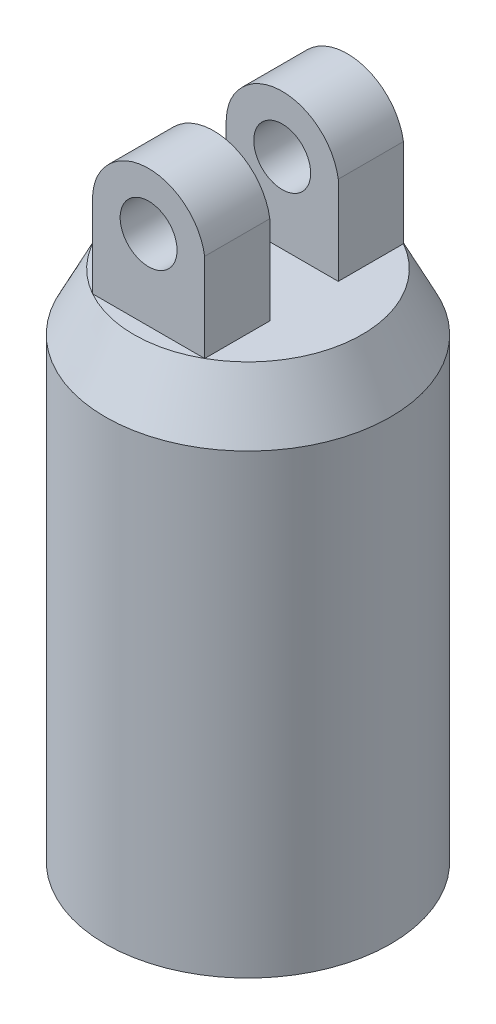
from build123d import *

# Parameters (mm, degrees)
SKETCH_1_R          = 12.5
SKETCH_1_R_2        = 5
EXTRUDE_1_DEPTH     = 40
SKETCH_9_W          = 9.82849153
SKETCH_9_H          = 17.418402746
EXTRUDE_4_DEPTH     = 15
SKETCH_12_R         = 2.492986731
CUT_EXTRUDE_2_DEPTH = 65.854299957
CUT_EXTRUDE_3_DEPTH = 65.854299957
CUT_EXTRUDE_4_DEPTH = 65.854299957
CUT_EXTRUDE_5_DEPTH = 15


with BuildPart() as part:
    # Эскиз1 → Бобышка-Вытянуть1 (new body)
    with BuildSketch(Plane(origin=(0, 0, 0), x_dir=(1, 0, 0), z_dir=(0, 1, 0))):
        Circle(SKETCH_1_R)
        Circle(SKETCH_1_R_2, mode=Mode.SUBTRACT)
    extrude(amount=EXTRUDE_1_DEPTH)

    # Эскиз4 → Повернуть2 (revolve)
    with BuildSketch(Plane(origin=(0, 0, 0), x_dir=(0, 0, -1), z_dir=(1, 0, 0))):
        Polygon((-10, 45), (0, 45), (0, 39.999913314), (-12.5, 40), align=None)
    revolve(axis=Axis((0, 39.999913314, 0), (0, 1, 0)))

    # Эскиз9 → Бобышка-Вытянуть4 (add)
    with BuildSketch(Plane(origin=(0, 45, 0), x_dir=(1, 0, 0), z_dir=(0, 1, 0))):
        Rectangle(SKETCH_9_W, SKETCH_9_H)
    extrude(amount=EXTRUDE_4_DEPTH)

    # Эскиз12 → Вырез-Вытянуть2 (cut, through all)
    with BuildSketch(Plane.XY.offset(8.709201373)):
        with Locations((0, 52)):
            Circle(SKETCH_12_R)
    extrude(amount=-CUT_EXTRUDE_2_DEPTH, mode=Mode.SUBTRACT)

    # Эскиз12<4> → Вырез-Вытянуть3 (cut, through all)
    with BuildSketch(Plane.XY.offset(8.709201373)):
        with BuildLine():
            Line((0, 57.060476342), (0, 60))
            Line((0, 60), (-4.914245765, 60))
            Line((-4.914245765, 60), (-4.914245765, 52.146230577))
            ThreePointArc((-4.914245765, 52.146230577), (-3.474896505, 55.621127082), (0, 57.060476342))
        make_face()
    extrude(amount=-CUT_EXTRUDE_3_DEPTH, mode=Mode.SUBTRACT)

    # Эскиз14 → Вырез-Вытянуть4 (cut, through all)
    with BuildSketch(Plane.XY.offset(8.709201373)):
        with BuildLine():
            ThreePointArc((-4.534941492, 54.039407036), (0.668025232, 56.927333729), (4.914245765, 52.758329712))
            Line((4.914245765, 52.758329712), (4.914245765, 53.845840784))
            Line((4.914245765, 53.845840784), (4.914245765, 60))
            Line((4.914245765, 60), (0, 60))
            Line((0, 60), (0, 57.060476342))
            ThreePointArc((0, 57.060476342), (-2.724543727, 56.236056113), (-4.534941492, 54.039407036))
        make_face()
    extrude(amount=-CUT_EXTRUDE_4_DEPTH, mode=Mode.SUBTRACT)

    # Эскиз15 → Вырез-Вытянуть5 (cut)
    with BuildSketch(Plane(origin=(4.914245765, 0, 0), x_dir=(0, 0, -1), z_dir=(1, 0, 0))):
        Polygon((-3, 45), (-3, 52.758329712), (-3, 60.738034658), (3, 60.738034658), (3, 45), (0, 45), align=None)
    extrude(amount=-CUT_EXTRUDE_5_DEPTH, mode=Mode.SUBTRACT)


solid = part.part
